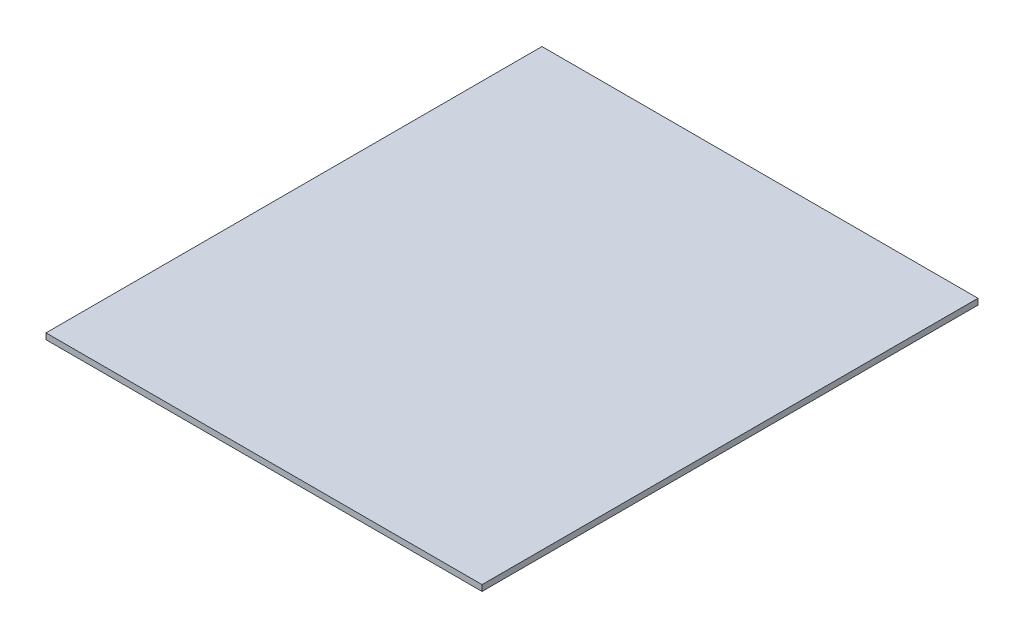
from build123d import *

# Parameters (mm, degrees)
SKETCH1_W           = 219.79
SKETCH1_H           = 250
BOSS_EXTRUDE1_DEPTH = 3


with BuildPart() as part:
    # Sketch1 → Boss-Extrude1 (new body)
    with BuildSketch(Plane(origin=(0, 0, 0), x_dir=(1, 0, 0), z_dir=(0, 1, 0))):
        with Locations((109.895, 125)):
            Rectangle(SKETCH1_W, SKETCH1_H)
    extrude(amount=BOSS_EXTRUDE1_DEPTH)


solid = part.part
